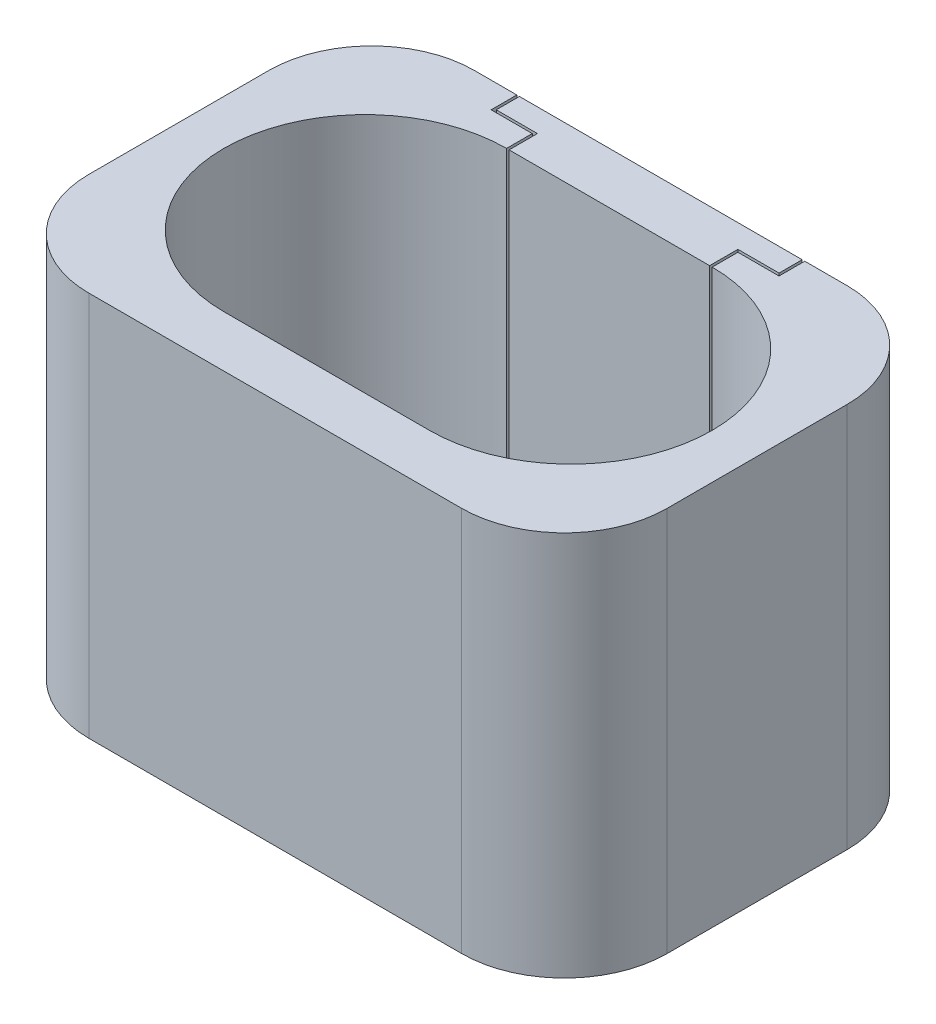
from build123d import *

# Parameters (mm, degrees)
SKETCH1_W           = 22.5
SKETCH1_H           = 15
BOSS_EXTRUDE1_DEPTH = 7.5
CUT_EXTRUDE1_DEPTH  = 31.923292192
CUT_EXTRUDE2_REACH  = 30.062
SKETCH3_W           = 8
SKETCH3_H           = 15
SKETCH4_W           = 1.6
SKETCH4_H           = 1
CUT_EXTRUDE3_DEPTH  = 15
BOSS_EXTRUDE2_DEPTH = 15
FILLET1_R           = 4


with BuildPart() as part:
    # Sketch1 → Boss-Extrude1 (new, symmetric)
    with BuildSketch(Plane(origin=(0, 0, 0), x_dir=(1, 0, 0), z_dir=(0, 1, 0))):
        with Locations((-11.25, 7.5)):
            Rectangle(SKETCH1_W, SKETCH1_H)
    extrude(amount=BOSS_EXTRUDE1_DEPTH, both=True)

    # Sketch2 → Cut-Extrude1 (cut, through all)
    with BuildSketch(Plane(origin=(0, 7.5, 0), x_dir=(1, 0, 0), z_dir=(0, 1, 0))):
        with BuildLine():
            Line((-15.25, 13), (-7.25, 13))
            ThreePointArc((-7.25, 13), (-1.75, 7.5), (-7.25, 2))
            Line((-7.25, 2), (-15.25, 2))
            ThreePointArc((-15.25, 2), (-20.75, 7.5), (-15.25, 13))
        make_face()
    extrude(amount=-CUT_EXTRUDE1_DEPTH, mode=Mode.SUBTRACT)

    # Sketch3 → Cut-Extrude2 (cut, up to next)
    with BuildSketch(Plane(origin=(0, 0, -15), x_dir=(-1, 0, 0), z_dir=(0, 0, -1)), mode=Mode.PRIVATE) as cut_extrude2_sk1:
        with Locations((11.25, 0)):
            Rectangle(SKETCH3_W, SKETCH3_H)
    cut_extrude2_tool1 = extrude(cut_extrude2_sk1.sketch, amount=-CUT_EXTRUDE2_REACH, mode=Mode.PRIVATE) & part.part
    add(cut_extrude2_tool1.solids().sort_by_distance((-11.25, 0, -15))[0], mode=Mode.SUBTRACT)

    # Sketch4 → Cut-Extrude3 (cut)
    with BuildSketch(Plane(origin=(0, 7.5, 0), x_dir=(1, 0, 0), z_dir=(0, 1, 0))):
        with Locations((-16.05, 14.5)):
            Rectangle(SKETCH4_W, SKETCH4_H)
    cut_extrude3 = extrude(amount=-CUT_EXTRUDE3_DEPTH, mode=Mode.SUBTRACT)

    # Mirror1: Cut-Extrude3 across plane
    add(cut_extrude3.mirror(Plane.ZY.offset(11.25)), mode=Mode.SUBTRACT)

    # Fillet1
    fillet1_edges = [part.edges().sort_by_distance(p)[0] for p in [
        (-22.5, 0, 0),
        (-22.5, 0, -15),
        (0, 0, -15),
        (0, 0, 0),
    ]]
    fillet(fillet1_edges, radius=FILLET1_R)


with BuildPart() as body_2:
    # Sketch5 → Boss-Extrude2 (new, through all)
    with BuildSketch(Plane(origin=(0, 7.5, 0), x_dir=(1, 0, 0), z_dir=(0, 1, 0))):
        Polygon((-11.25, 15), (-15.15, 15), (-16.75, 15), (-16.75, 14.1), (-15.15, 14.1), (-15.15, 13), (-11.25, 13), align=None)
    extrude(amount=-BOSS_EXTRUDE2_DEPTH)

    # Mirror3: body 2 across plane


with BuildPart() as body_2_1:
    add(body_2.part)
    add(body_2.part.mirror(Plane.ZY.offset(11.25)))


solid = Compound([part.part, body_2_1.part])
